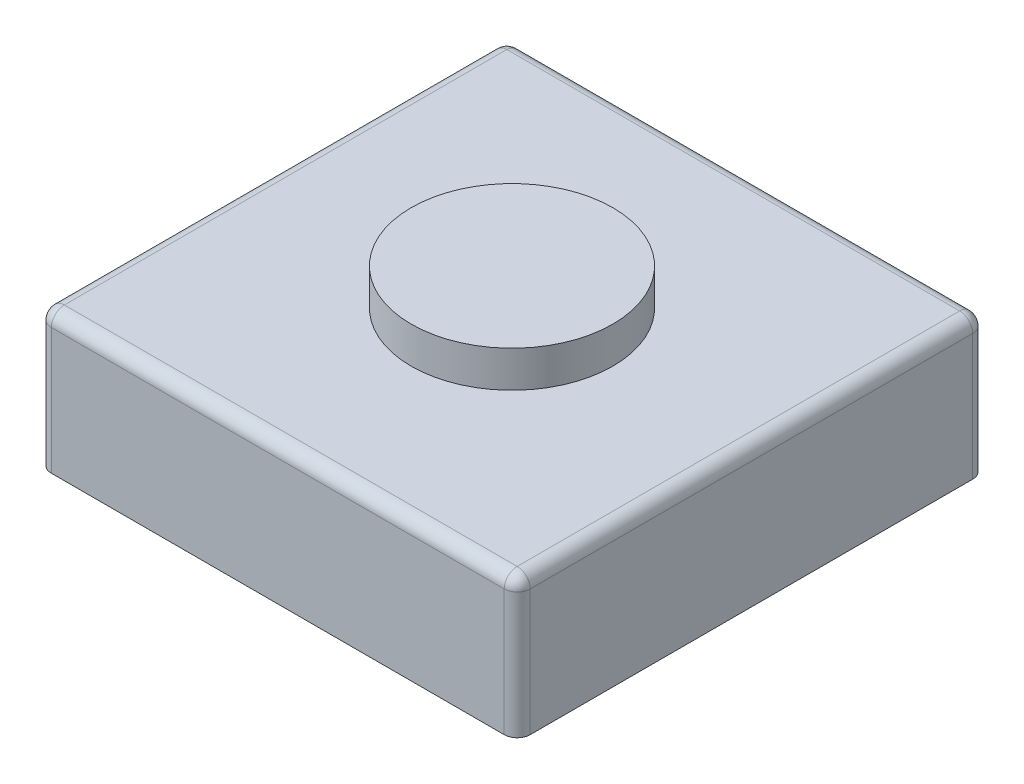
from build123d import *

# Parameters (mm, degrees)
SKETCH_1_W      = 36.8
SKETCH_1_H      = 36
EXTRUDE_1_DEPTH = 10.7
FILLET_1_R      = 1
SKETCH_2_R      = 7.75
EXTRUDE_2_DEPTH = 2.8


with BuildPart() as part:
    # 草图1 → 凸台-拉伸1 (new body)
    with BuildSketch(Plane(origin=(0, 0, 0), x_dir=(1, 0, 0), z_dir=(0, 1, 0))):
        with Locations((2.46557377, -7.672131148)):
            Rectangle(SKETCH_1_W, SKETCH_1_H)
    extrude(amount=EXTRUDE_1_DEPTH)

    # 圆角1
    fillet_1_edges = [part.edges().sort_by_distance(p)[0] for p in [
        (20.86557377, 10.7, 7.672131148),
        (2.46557377, 10.7, -10.327868852),
        (-15.93442623, 10.7, 7.672131148),
        (-15.93442623, 5.35, -10.327868852),
        (20.86557377, 5.35, -10.327868852),
        (20.86557377, 5.35, 25.672131148),
        (-15.93442623, 5.35, 25.672131148),
        (2.46557377, 10.7, 25.672131148),
    ]]
    fillet(fillet_1_edges, radius=FILLET_1_R)

    # 草图2 → 凸台-拉伸2 (add)
    with BuildSketch(Plane(origin=(0, 10.7, 0), x_dir=(1, 0, 0), z_dir=(0, 1, 0))):
        with Locations(Location((2.46557377, -7.672131148, 0), (0, 0, 270))):
            Circle(SKETCH_2_R)
    extrude(amount=EXTRUDE_2_DEPTH)


solid = part.part
